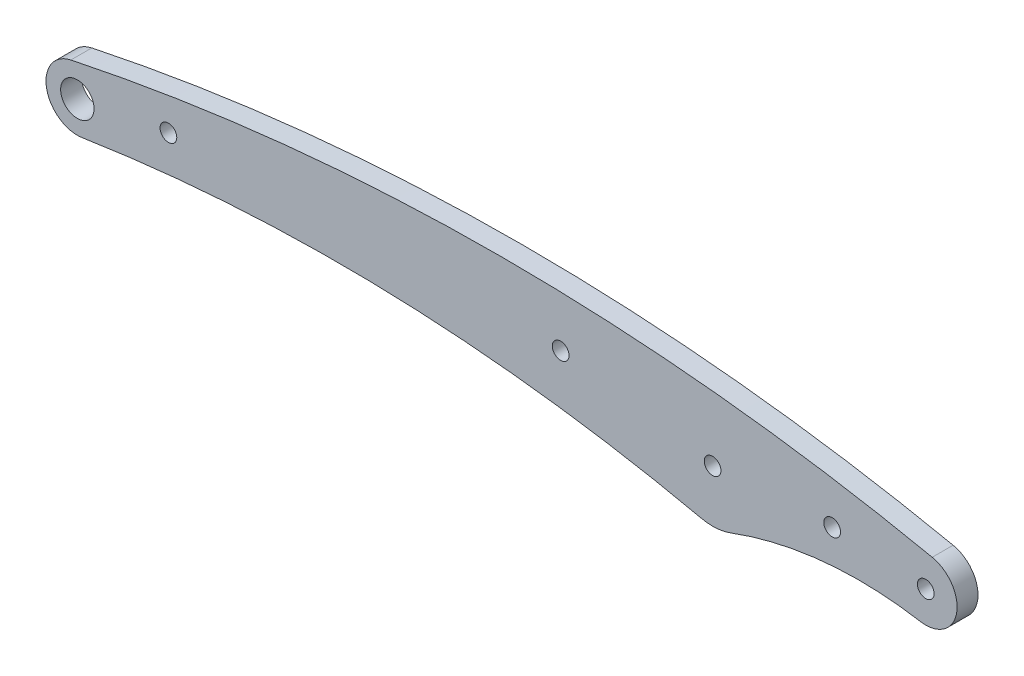
from build123d import *

# Parameters (mm, degrees)
SCHIZZO1_R                   = 4
SCHIZZO1_R_2                 = 2
ESTRUSIONE_ESTRUSIONE1_DEPTH = 5
SCHIZZO2_R                   = 2
TAGLIO_ESTRUSIONE1_DEPTH     = 10


with BuildPart() as part:
    # Schizzo1 → Estrusione-Estrusione1 (new body)
    with BuildSketch(Plane.XY):
        with BuildLine():
            ThreePointArc((-1.545685279, 7.338995641), (-7.37775549, -1.348600733), (1.150548918, -7.411223731))
            ThreePointArc((1.150548918, -7.411223731), (75.443261143, -2.885528453), (149.288277512, -12.20231786))
            ThreePointArc((149.288277512, -12.20231786), (152.870711747, -12.469637567), (156.381230514, -11.707041436))
            ThreePointArc((156.381230514, -11.707041436), (178.7761584, -6.547142951), (201.742232266, -7.393782545))
            ThreePointArc((201.742232266, -7.393782545), (210.367795627, -1.401994151), (204.545685279, 7.338995641))
            ThreePointArc((204.545685279, 7.338995641), (101.5, 18.072619578), (-1.545685279, 7.338995641))
        make_face()
        Circle(SCHIZZO1_R, mode=Mode.SUBTRACT)
        with Locations((203, 0)):
            Circle(SCHIZZO1_R_2, mode=Mode.SUBTRACT)
        with Locations((152, 0)):
            Circle(SCHIZZO1_R_2, mode=Mode.SUBTRACT)
    extrude(amount=ESTRUSIONE_ESTRUSIONE1_DEPTH)

    # Schizzo2 → Taglio-Estrusione1 (cut)
    with BuildSketch(Plane.XY.offset(5)):
        with Locations((21.792647349, 3.923925867)):
            Circle(SCHIZZO2_R)
        with Locations((115.643522851, 5.673925867)):
            Circle(SCHIZZO2_R)
        with Locations((180.602574062, 1.58663817)):
            Circle(SCHIZZO2_R)
    extrude(amount=-TAGLIO_ESTRUSIONE1_DEPTH, mode=Mode.SUBTRACT)


solid = part.part
